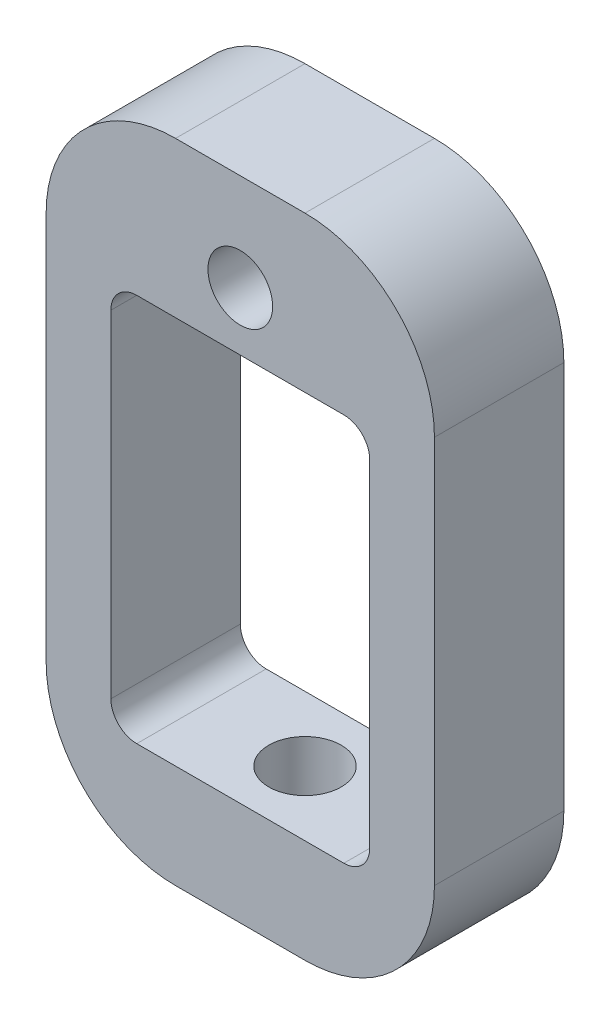
from build123d import *

# Parameters (mm, degrees)
SKETCH1_W           = 15
SKETCH1_H           = 25
SKETCH1_R           = 1.25
SKETCH1_W_2         = 10
SKETCH1_H_2         = 15
BOSS_EXTRUDE1_DEPTH = 5
SKETCH2_R           = 1.4
CUT_EXTRUDE1_DEPTH  = 4
FILLET1_R           = 5
FILLET2_R           = 1


with BuildPart() as part:
    # Sketch1 → Boss-Extrude1 (new body)
    with BuildSketch(Plane.XY):
        with Locations((7.5, -12.5)):
            Rectangle(SKETCH1_W, SKETCH1_H)
        with Locations((7.5, -3.75)):
            Circle(SKETCH1_R, mode=Mode.SUBTRACT)
        with Locations((7.5, -13.5)):
            Rectangle(SKETCH1_W_2, SKETCH1_H_2, mode=Mode.SUBTRACT)
    extrude(amount=BOSS_EXTRUDE1_DEPTH)

    # Sketch2 → Cut-Extrude1 (cut)
    with BuildSketch(Plane.XZ.offset(25)):
        with Locations(Location((7.5, 2.5, 0), (0, 0, 270))):
            Circle(SKETCH2_R)
    extrude(amount=-CUT_EXTRUDE1_DEPTH, mode=Mode.SUBTRACT)

    # Fillet1
    fillet1_edges = [part.edges().sort_by_distance(p)[0] for p in [
        (0, 0, 2.5),
        (15, 0, 2.5),
        (15, -25, 2.5),
        (0, -25, 2.5),
    ]]
    fillet(fillet1_edges, radius=FILLET1_R)

    # Fillet2
    fillet2_edges = [part.edges().sort_by_distance(p)[0] for p in [
        (12.5, -21, 2.5),
        (12.5, -6, 2.5),
        (2.5, -6, 2.5),
        (2.5, -21, 2.5),
    ]]
    fillet(fillet2_edges, radius=FILLET2_R)


solid = part.part
